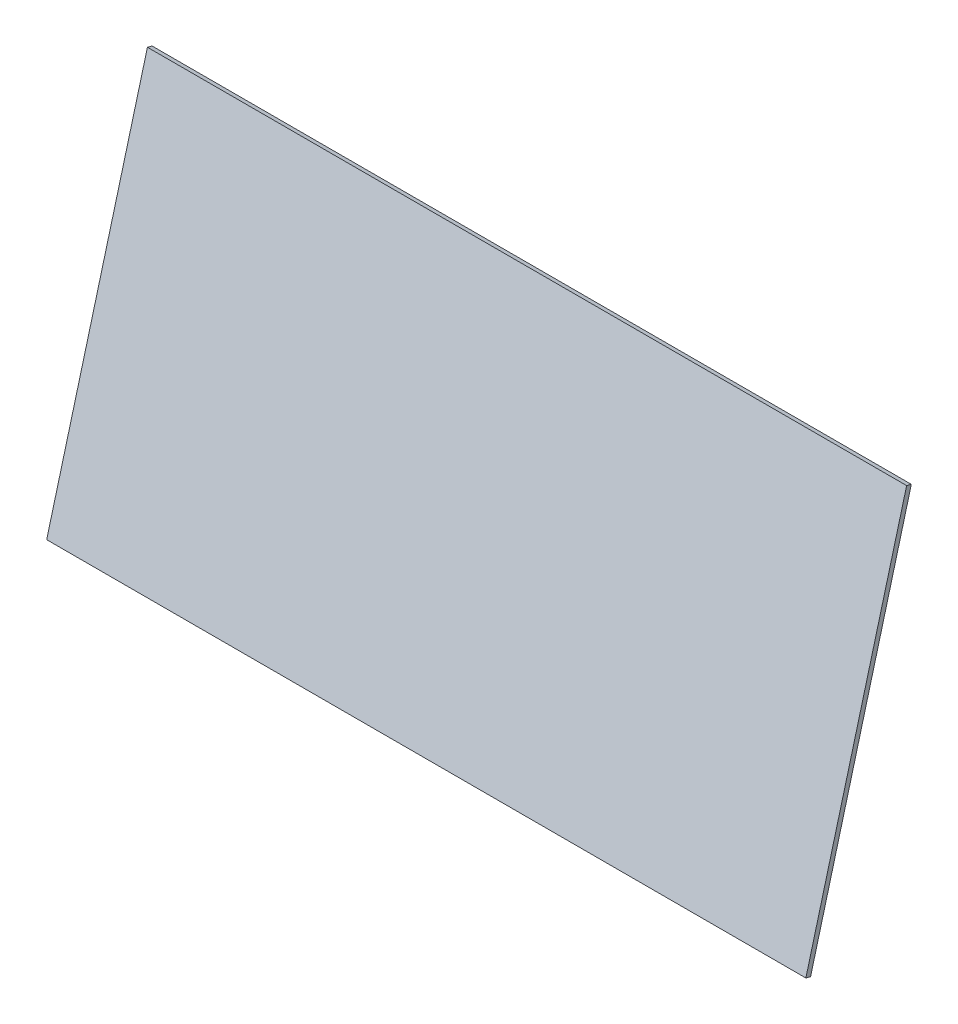
from build123d import *

# Parameters (mm, degrees)
EXTRUDE_THIN1_DEPTH = 78


with BuildPart() as part:
    # Sketch1 → Extrude-Thin1 (new body)
    with BuildSketch(Plane(origin=(0, 0, 0), x_dir=(0, 0, -1), z_dir=(1, 0, 0))):
        Polygon((0, 0), (10.352761804, 38.637033052), (10.835724717, 38.507623529), (0.482962913, -0.129409523), align=None)
    extrude(amount=-EXTRUDE_THIN1_DEPTH)


solid = part.part
